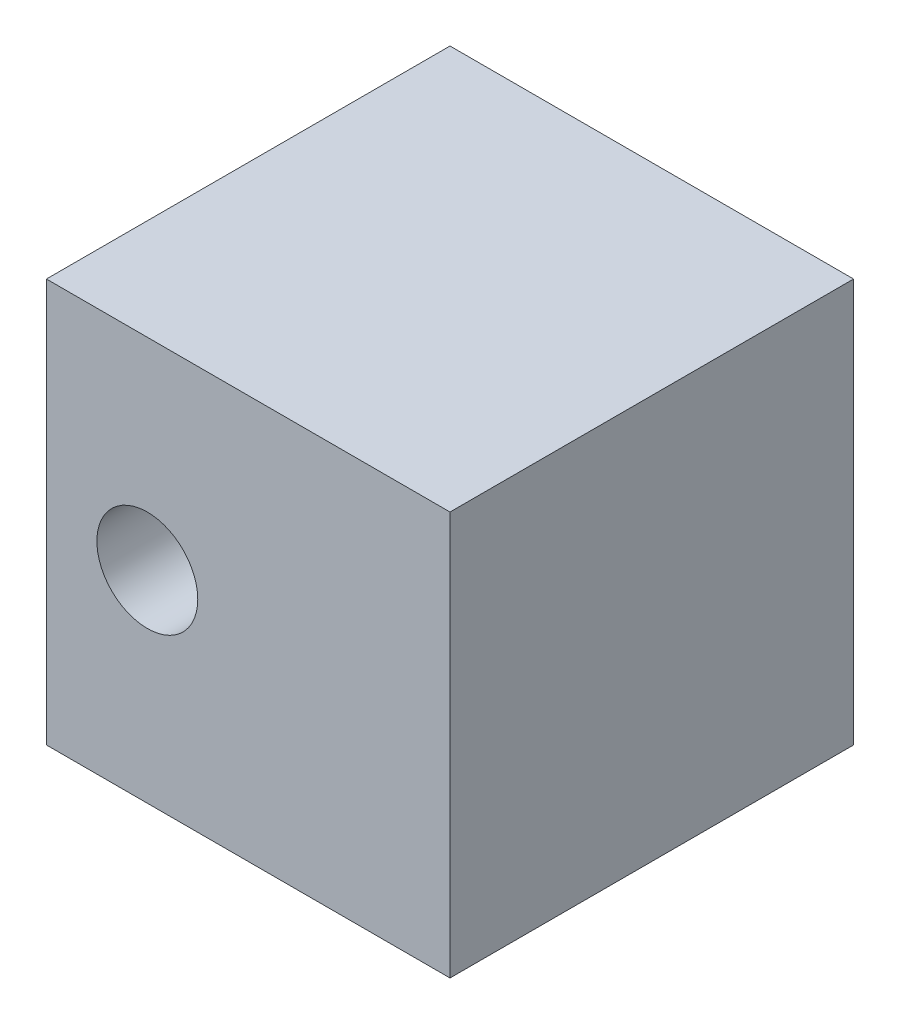
from build123d import *

# Parameters (mm, degrees)
SKETCH1_W           = 25.4
SKETCH1_H           = 25.4
BOSS_EXTRUDE1_DEPTH = 25.4
SKETCH2_R           = 3.175
CUT_EXTRUDE1_DEPTH  = 44.994090512


with BuildPart() as part:
    # Sketch1 → Boss-Extrude1 (new body)
    with BuildSketch(Plane(origin=(0, 0, 0), x_dir=(1, 0, 0), z_dir=(0, 1, 0))):
        with Locations((12.7, 12.7)):
            Rectangle(SKETCH1_W, SKETCH1_H)
    extrude(amount=BOSS_EXTRUDE1_DEPTH)

    # Sketch2 → Cut-Extrude1 (cut, through all)
    with BuildSketch(Plane.XY):
        with Locations((6.35, 12.7)):
            Circle(SKETCH2_R)
    extrude(amount=-CUT_EXTRUDE1_DEPTH, mode=Mode.SUBTRACT)


solid = part.part
